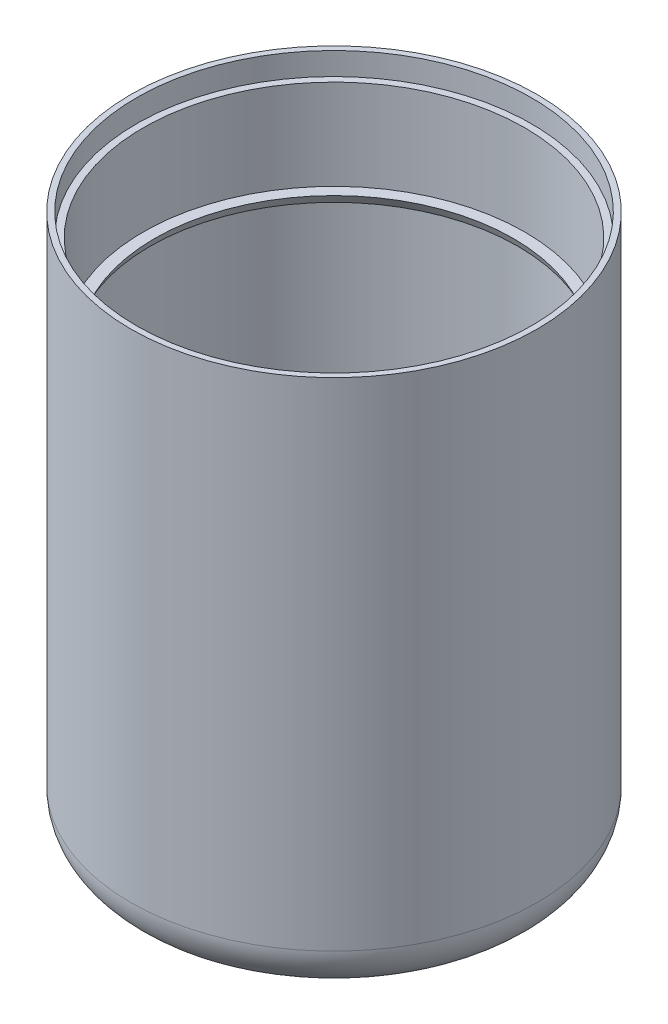
from build123d import *

# Parameters (mm, degrees)
SKETCH2_R          = 3
CUT_EXTRUDE1_DEPTH = 103.225241501


with BuildPart() as part:
    # Sketch1 → Revolve1 (revolve)
    with BuildSketch(Plane(origin=(0, 0, 0), x_dir=(0, 0, -1), z_dir=(1, 0, 0))):
        with BuildLine():
            Line((-43.75, 55), (-45, 55))
            Line((-45, 55), (-45, -55))
            ThreePointArc((-45, -55), (-42.071067812, -62.071067812), (-35, -65))
            Line((-35, -65), (-15, -65))
            ThreePointArc((-15, -65), (-7.928932188, -67.928932188), (-5, -75))
            Line((-5, -75), (-5, -80))
            Line((-5, -80), (-4, -80))
            Line((-4, -80), (-4, -70))
            ThreePointArc((-4, -70), (-6.928932188, -62.928932188), (-14, -60))
            Line((-14, -60), (-30, -60))
            ThreePointArc((-30, -60), (-37.071067812, -57.071067812), (-40, -50))
            Line((-40, -50), (-40, -18.031088913))
            Line((-40, -18.031088913), (-38.25, -15))
            Line((-38.25, -15), (-40.75, -15))
            Line((-40.75, -15), (-40.75, 28))
            Line((-40.75, 28), (-39.75, 30))
            Line((-39.75, 30), (-42.25, 30))
            Line((-42.25, 30), (-42.25, 50))
            Line((-42.25, 50), (-43.75, 50))
            Line((-43.75, 50), (-43.75, 55))
        make_face()
    revolve(axis=Axis((0, 48.80804048, 0), (0, -1, 0)))

    # Sketch2 → Cut-Extrude1 (cut, through all)
    with BuildSketch(Plane.XY):
        with Locations((0, -10)):
            Circle(SKETCH2_R)
    extrude(amount=-CUT_EXTRUDE1_DEPTH, mode=Mode.SUBTRACT)


solid = part.part
